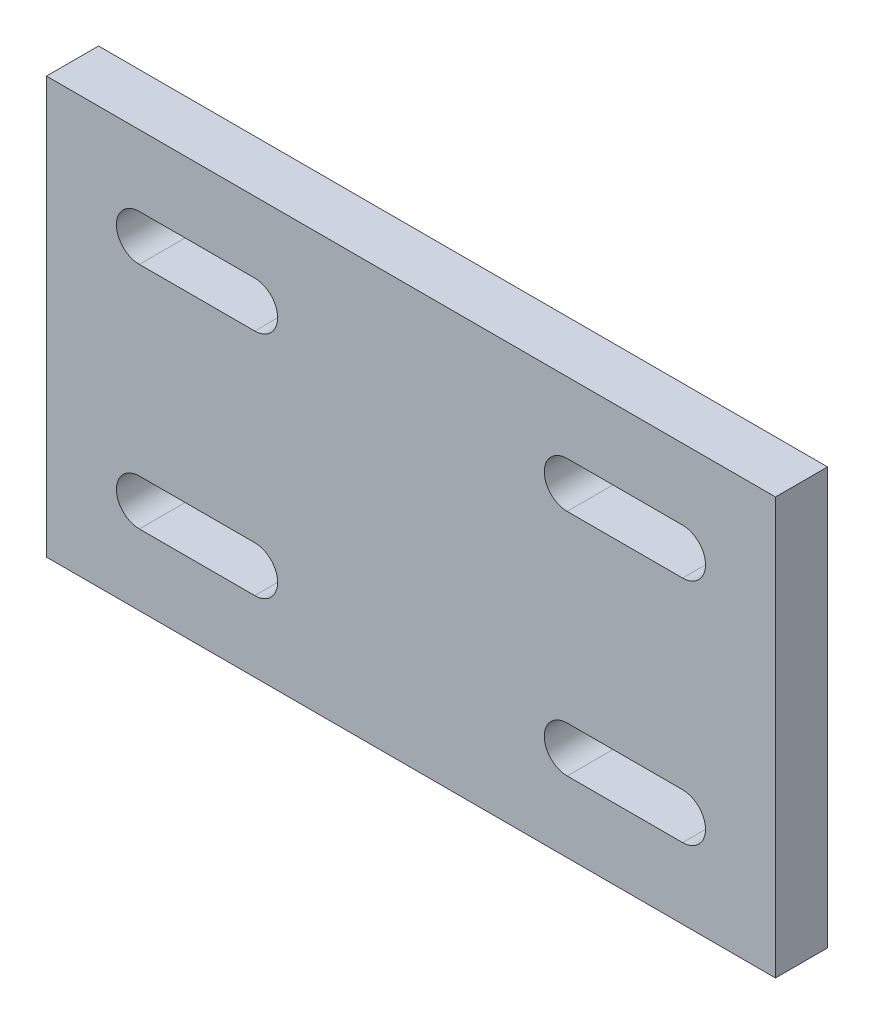
from build123d import *

# Parameters (mm, degrees)
SKETCH1_W            = 70
SKETCH1_H            = 40
BOSS_EXTRUDE1_DEPTH  = 5
CUT_EXTRUDE1_DEPTH   = 41.620192023
MIRROR3_COPY_1_DEPTH = 41.620192023
MIRROR3_COPY_2_DEPTH = 41.620192023


with BuildPart() as part:
    # Sketch1 → Boss-Extrude1 (new body)
    with BuildSketch(Plane.XY):
        Rectangle(SKETCH1_W, SKETCH1_H)
    extrude(amount=BOSS_EXTRUDE1_DEPTH)

    # Sketch3 → Cut-Extrude1 (cut, through all)
    with BuildSketch(Plane.XY.offset(5)):
        with BuildLine():
            Line((-26.080867749, 13.2), (-15, 13.2))
            ThreePointArc((-15, 13.2), (-12.8, 11), (-15, 8.8))
            Line((-15, 8.8), (-26.080867749, 8.8))
            ThreePointArc((-26.080867749, 8.8), (-28.280867749, 11), (-26.080867749, 13.2))
        make_face()
    cut_extrude1 = extrude(amount=-CUT_EXTRUDE1_DEPTH, mode=Mode.SUBTRACT)

    # Mirror2: Cut-Extrude1 across plane
    add(cut_extrude1.mirror(Plane(origin=(0, 0, 0), x_dir=(0, 0, 1), z_dir=(1, 0, 0))), mode=Mode.SUBTRACT)

    # Mirror3 copy 1 sketch → Mirror3 copy 1 (cut, through all)
    with BuildSketch(Plane(origin=(0, 0, 5), x_dir=(-1, 0, 0), z_dir=(0, 0, 1))):
        with BuildLine():
            Line((-26.080867749, 13.2), (-15, 13.2))
            ThreePointArc((-15, 13.2), (-12.8, 11), (-15, 8.8))
            Line((-15, 8.8), (-26.080867749, 8.8))
            ThreePointArc((-26.080867749, 8.8), (-28.280867749, 11), (-26.080867749, 13.2))
        make_face()
    extrude(amount=-MIRROR3_COPY_1_DEPTH, mode=Mode.SUBTRACT)

    # Mirror3 copy 2 sketch → Mirror3 copy 2 (cut, through all)
    with BuildSketch(Plane.XY.offset(5)):
        with BuildLine():
            Line((-26.080867749, -13.2), (-15, -13.2))
            ThreePointArc((-15, -13.2), (-12.8, -11), (-15, -8.8))
            Line((-15, -8.8), (-26.080867749, -8.8))
            ThreePointArc((-26.080867749, -8.8), (-28.280867749, -11), (-26.080867749, -13.2))
        make_face()
    extrude(amount=-MIRROR3_COPY_2_DEPTH, mode=Mode.SUBTRACT)


solid = part.part
